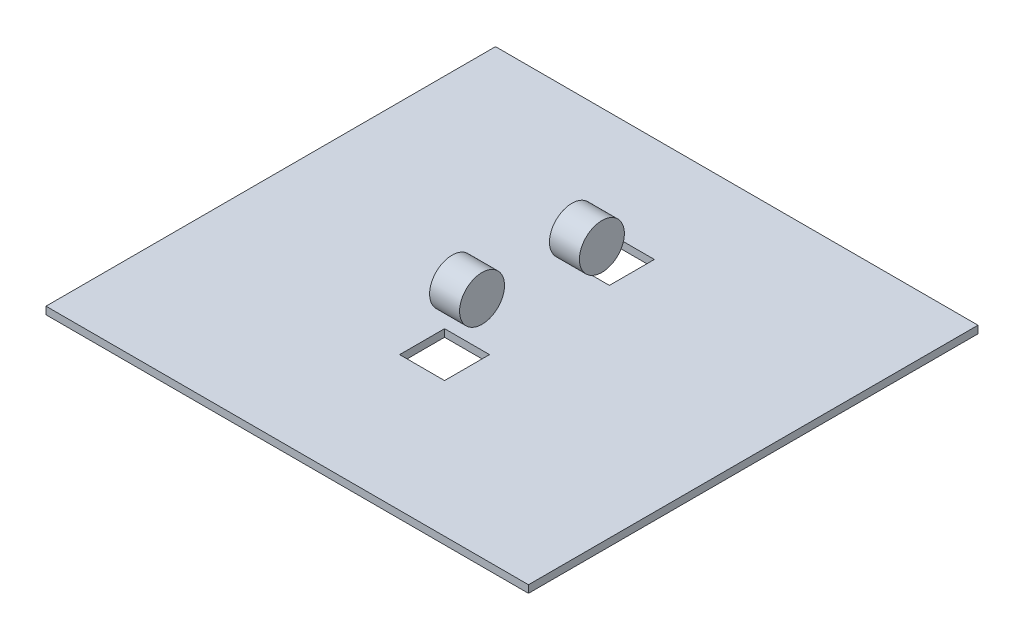
from build123d import *

# Parameters (mm, degrees)
SKETCH_1_W          = 322
SKETCH_1_H          = 300
EXTRUDE_1_DEPTH     = 5
SKETCH_2_W          = 30
SKETCH_2_H          = 30
CUT_EXTRUDE_1_DEPTH = 5
CUT_EXTRUDE_2_DEPTH = 2
CUT_EXTRUDE_3_DEPTH = 2
SKETCH_5_R          = 15
EXTRUDE_3_DEPTH     = 10
EXTRUDE_3_2_DEPTH   = 10


with BuildPart() as part:
    # 스케치1 → 보스-돌출1 (new body)
    with BuildSketch(Plane(origin=(0, 0, 0), x_dir=(1, 0, 0), z_dir=(0, 1, 0))):
        with Locations((161, 150)):
            Rectangle(SKETCH_1_W, SKETCH_1_H)
    extrude(amount=EXTRUDE_1_DEPTH)

    # 스케치2 → 컷-돌출1 (cut)
    with BuildSketch(Plane(origin=(0, 5, 0), x_dir=(1, 0, 0), z_dir=(0, 1, 0))):
        with Locations((161, 105)):
            Rectangle(SKETCH_2_W, SKETCH_2_H)
        with Locations((161, 215)):
            Rectangle(SKETCH_2_W, SKETCH_2_H)
    extrude(amount=-CUT_EXTRUDE_1_DEPTH, mode=Mode.SUBTRACT)

    # 스케치3 → 컷-돌출2 (cut)
    with BuildSketch(Plane.XZ):
        with BuildLine():
            ThreePointArc((62.5, -105), (70, -112.5), (77.5, -105))
            Line((77.5, -105), (62.5, -105))
        make_face()
        with BuildLine():
            Line((62.5, -105), (77.5, -105))
            ThreePointArc((77.5, -105), (70, -97.5), (62.5, -105))
        make_face()
        with BuildLine():
            ThreePointArc((244.5, -105), (252, -112.5), (259.5, -105))
            Line((259.5, -105), (244.5, -105))
        make_face()
        with BuildLine():
            Line((244.5, -105), (259.5, -105))
            ThreePointArc((259.5, -105), (252, -97.5), (244.5, -105))
        make_face()
    extrude(amount=-CUT_EXTRUDE_2_DEPTH, mode=Mode.SUBTRACT)

    # 스케치4 → 컷-돌출3 (cut)
    with BuildSketch(Plane.XZ):
        with BuildLine():
            ThreePointArc((209.5, -215), (202, -207.5), (194.5, -215))
            Line((194.5, -215), (209.5, -215))
        make_face()
        with BuildLine():
            Line((209.5, -215), (194.5, -215))
            ThreePointArc((194.5, -215), (202, -222.5), (209.5, -215))
        make_face()
        with BuildLine():
            ThreePointArc((127.5, -215), (120, -207.5), (112.5, -215))
            Line((112.5, -215), (127.5, -215))
        make_face()
        with BuildLine():
            Line((127.5, -215), (112.5, -215))
            ThreePointArc((112.5, -215), (120, -222.5), (127.5, -215))
        make_face()
    extrude(amount=-CUT_EXTRUDE_3_DEPTH, mode=Mode.SUBTRACT)


with BuildPart() as body_2:
    # 스케치5 → 보스-돌출3 (new, symmetric)
    with BuildSketch(Plane(origin=(161, 0, 0), x_dir=(0, 0, -1), z_dir=(1, 0, 0))):
        with Locations((120, 35)):
            Circle(SKETCH_5_R)
    extrude(amount=EXTRUDE_3_DEPTH, both=True)


with BuildPart() as body_3:
    # 스케치5 → Extrude 3 2 (new, symmetric)
    with BuildSketch(Plane(origin=(161, 0, 0), x_dir=(0, 0, -1), z_dir=(1, 0, 0))):
        with Locations((200, 25)):
            Circle(SKETCH_5_R)
    extrude(amount=EXTRUDE_3_2_DEPTH, both=True)


solid = Compound([part.part, body_2.part, body_3.part])
